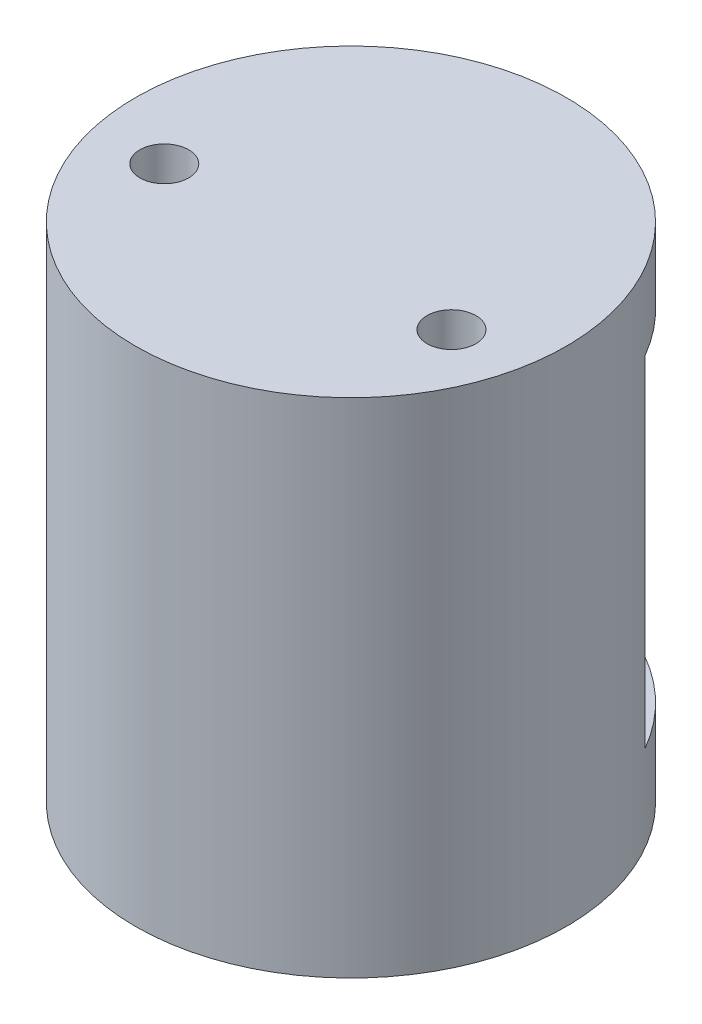
from build123d import *

# Parameters (mm, degrees)
SKETCH1_R               = 15
BOSS_EXTRUDE1_DEPTH     = 35
CUT_EXTRUDE4_DEPTH      = 13
CUT_EXTRUDE4_DEPTH_BACK = 16
CUT_EXTRUDE5_DEPTH      = 1.5
SKETCH7_R               = 2.1
CUT_EXTRUDE6_DEPTH      = 2.2
CUT_EXTRUDE7_REACH      = 42.927
SKETCH8_R               = 1.7


with BuildPart() as part:
    # Sketch1 → Boss-Extrude1 (new body)
    with BuildSketch(Plane(origin=(0, 0, 0), x_dir=(1, 0, 0), z_dir=(0, 1, 0))):
        with Locations(Location((0, 0, 0), (0, 0, 270))):
            Circle(SKETCH1_R)
    extrude(amount=BOSS_EXTRUDE1_DEPTH)

    # Sketch5 → Cut-Extrude4 (cut, two sides: drawn at the far end of the back side and taken through both)
    with BuildSketch(Plane(origin=(0, 0, 0), x_dir=(0, 0, -1), z_dir=(1, 0, 0)).offset(-CUT_EXTRUDE4_DEPTH_BACK)):
        Polygon((-6, 30.7), (-6, 5), (0.5, 5), (0.5, 6), (16, 6), (16, 29.7), (0.5, 29.7), (0.5, 30.7), align=None)
    extrude(amount=CUT_EXTRUDE4_DEPTH + CUT_EXTRUDE4_DEPTH_BACK, mode=Mode.SUBTRACT)

    # Sketch6 → Cut-Extrude5 (cut)
    with BuildSketch(Plane.XZ):
        with BuildLine():
            Line((-9.697937925, 8.2), (9.697937925, 8.2))
            ThreePointArc((9.697937925, 8.2), (0, -12.7), (-9.697937925, 8.2))
        make_face()
    extrude(amount=-CUT_EXTRUDE5_DEPTH, mode=Mode.SUBTRACT)

    # Sketch7 → Cut-Extrude6 (cut)
    with BuildSketch(Plane.XZ.offset(-1.5)):
        with Locations(Location((0, -6, 0), (0, 0, 270))):
            Circle(SKETCH7_R)
    extrude(amount=-CUT_EXTRUDE6_DEPTH, mode=Mode.SUBTRACT)

    # Sketch8 → Cut-Extrude7 (cut, up to next)
    with BuildSketch(Plane(origin=(0, 35, 0), x_dir=(1, 0, 0), z_dir=(0, 1, 0)), mode=Mode.PRIVATE) as cut_extrude7_sk1:
        with Locations(Location((-10, -3, 0), (0, 0, 270))):
            Circle(SKETCH8_R)
    cut_extrude7_tool1 = extrude(cut_extrude7_sk1.sketch, amount=-CUT_EXTRUDE7_REACH, mode=Mode.PRIVATE) & part.part
    # Sketch8 → Cut-Extrude7 (cut, up to next)
    with BuildSketch(Plane(origin=(0, 35, 0), x_dir=(1, 0, 0), z_dir=(0, 1, 0)), mode=Mode.PRIVATE) as cut_extrude7_sk2:
        with Locations(Location((10, -3, 0), (0, 0, 270))):
            Circle(SKETCH8_R)
    cut_extrude7_tool2 = extrude(cut_extrude7_sk2.sketch, amount=-CUT_EXTRUDE7_REACH, mode=Mode.PRIVATE) & part.part
    add(cut_extrude7_tool1.solids().sort_by_distance((-10, 35, 3))[0], mode=Mode.SUBTRACT)
    add(cut_extrude7_tool2.solids().sort_by_distance((10, 35, 3))[0], mode=Mode.SUBTRACT)


solid = part.part
